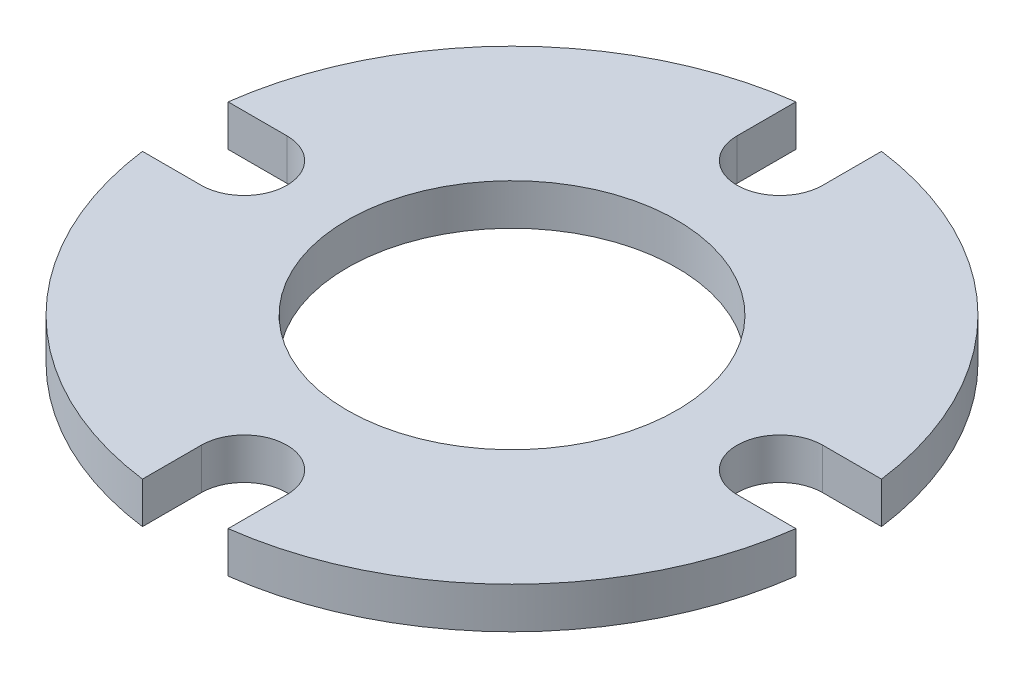
from build123d import *

# Parameters (mm, degrees)
SKETCH1_R           = 0.5
BOSS_EXTRUDE1_DEPTH = 0.0625


with BuildPart() as part:
    # Sketch1 → Boss-Extrude1 (new, symmetric)
    with BuildSketch(Plane(origin=(0, 0, 0), x_dir=(1, 0, 0), z_dir=(0, 1, 0))):
        with BuildLine():
            Line((0.813, -0.13), (0.991513994, -0.13))
            ThreePointArc((0.991513994, -0.13), (0.707106781, -0.707106781), (0.13, -0.991513994))
            Line((0.13, -0.991513994), (0.13, -0.813))
            ThreePointArc((0.13, -0.813), (0, -0.683), (-0.13, -0.813))
            Line((-0.13, -0.813), (-0.13, -0.991513994))
            ThreePointArc((-0.13, -0.991513994), (-0.707106781, -0.707106781), (-0.991513994, -0.13))
            Line((-0.991513994, -0.13), (-0.813, -0.13))
            ThreePointArc((-0.813, -0.13), (-0.683, 0), (-0.813, 0.13))
            Line((-0.813, 0.13), (-0.991513994, 0.13))
            ThreePointArc((-0.991513994, 0.13), (-0.707106781, 0.707106781), (-0.13, 0.991513994))
            Line((-0.13, 0.991513994), (-0.13, 0.813))
            ThreePointArc((-0.13, 0.813), (0, 0.683), (0.13, 0.813))
            Line((0.13, 0.813), (0.13, 0.991513994))
            ThreePointArc((0.13, 0.991513994), (0.707106781, 0.707106781), (0.991513994, 0.13))
            Line((0.991513994, 0.13), (0.813, 0.13))
            ThreePointArc((0.813, 0.13), (0.683, 0), (0.813, -0.13))
        make_face()
        with Locations(Location((0, 0, 0), (0, 0, 270))):
            Circle(SKETCH1_R, mode=Mode.SUBTRACT)
    extrude(amount=BOSS_EXTRUDE1_DEPTH, both=True)


solid = part.part
